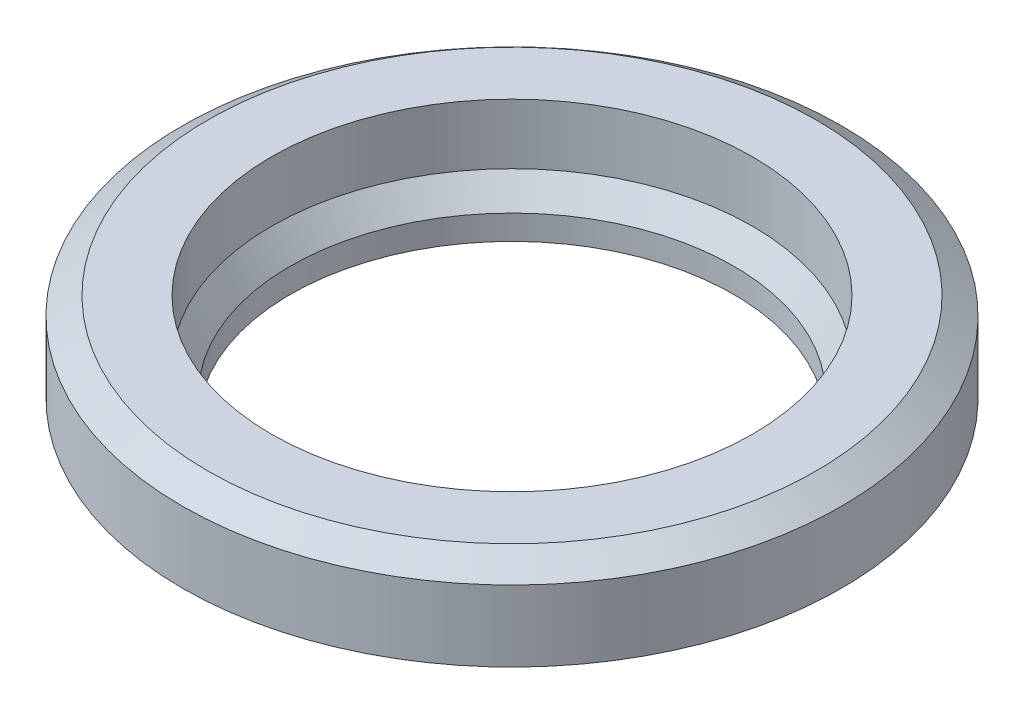
from build123d import *

# Parameters (mm, degrees)
REDONDEO1_R = 1


with BuildPart() as part:
    # Croquis1 → Revolución1 (revolve)
    with BuildSketch(Plane.XY, mode=Mode.PRIVATE) as revoluci_n1_sk:
        Polygon((-8.030896413, 0.557253855), (-8.030896413, 1.445392264), (-8.708681637, 2.358698791), (-8.708681637, 4.539307424), (-11.015589151, 4.539307424), (-11.937259367, 3.895637734), (-11.937259367, 1.322020013), (-8.708681637, 1.322020013), align=None)
    revolve(revoluci_n1_sk.sketch.rotate(Axis((0, 26.098695966, 0), (0, -1, 0)), 270), axis=Axis((0, 26.098695966, 0), (0, -1, 0)))

    # Redondeo1
    redondeo1_edges = [part.edges().sort_by_distance(p)[0] for p in [
        (0, 1.322020013, -8.708681637),
    ]]
    fillet(redondeo1_edges, radius=REDONDEO1_R)


solid = part.part
